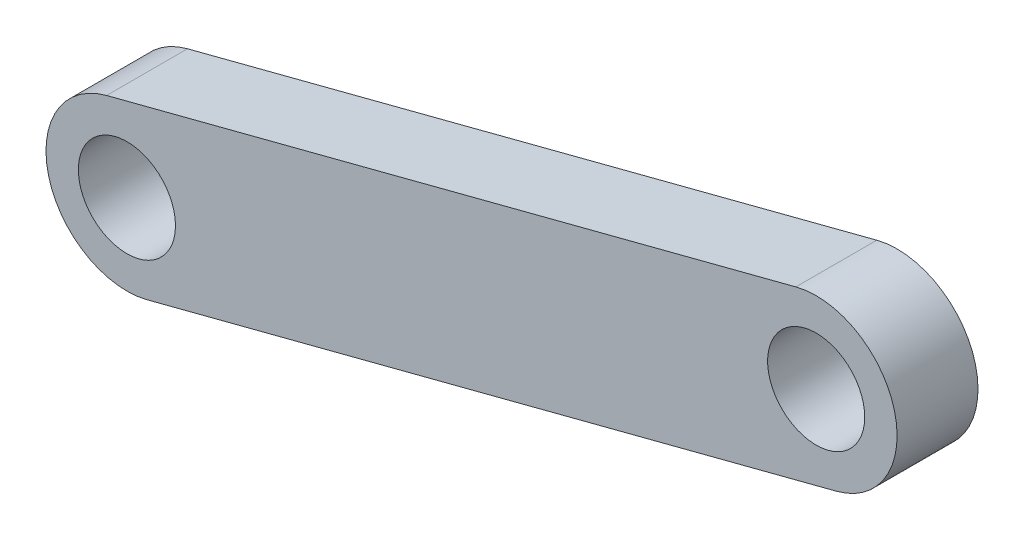
from build123d import *

# Parameters (mm, degrees)
CROQUIS1_R              = 1.5
CROQUIS1_R_2            = 1.500017804
SALIENTE_EXTRUIR1_DEPTH = 2.5


with BuildPart() as part:
    # Croquis1 → Saliente-Extruir1 (new body)
    with BuildSketch(Plane.XY):
        with BuildLine():
            ThreePointArc((-191.474459089, -32.774968889), (-193.266378613, -35.822758977), (-190.218588525, -37.614678501))
            Line((-190.218588525, -37.614678501), (-168.923866233, -32.08884802))
            ThreePointArc((-168.923866233, -32.08884802), (-167.131946709, -29.041057932), (-170.179736797, -27.249138408))
            Line((-170.179736797, -27.249138408), (-191.474459089, -32.774968889))
        make_face()
        with Locations((-190.846523807, -35.194823695)):
            Circle(CROQUIS1_R, mode=Mode.SUBTRACT)
        with Locations((-169.551801515, -29.668993214)):
            Circle(CROQUIS1_R_2, mode=Mode.SUBTRACT)
    extrude(amount=SALIENTE_EXTRUIR1_DEPTH)


solid = part.part
